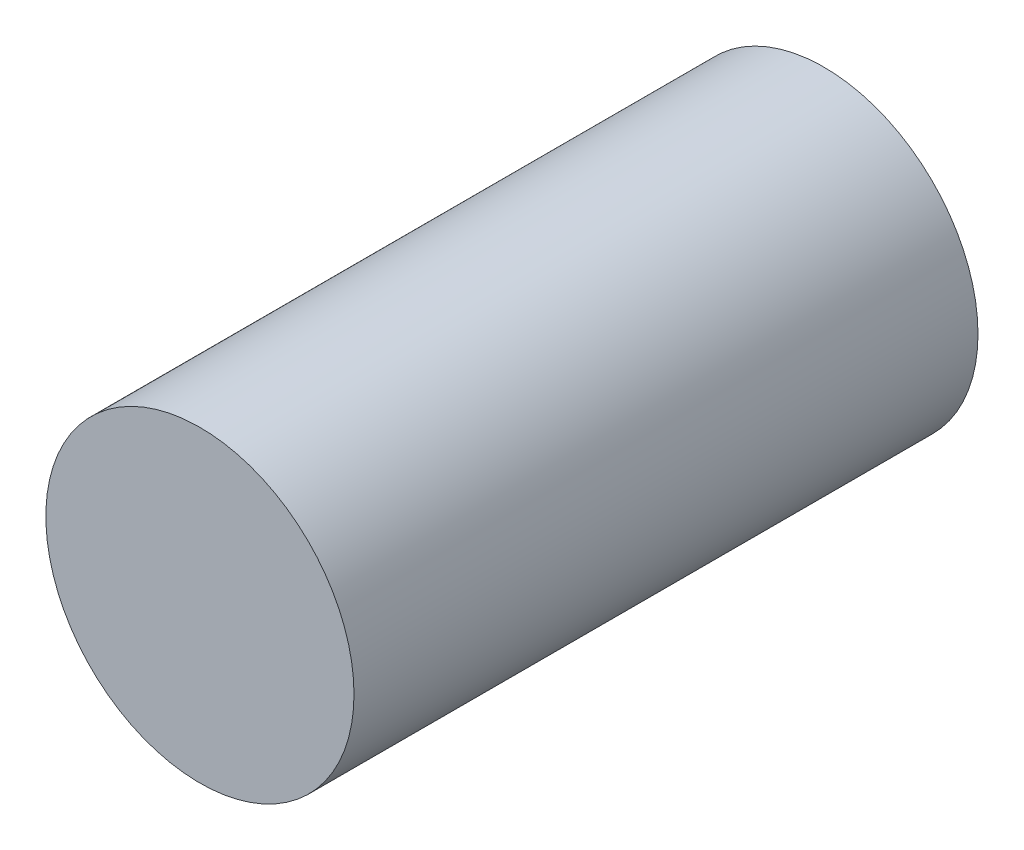
from build123d import *

# Parameters (mm, degrees)
SKETCH1_R           = 40
BOSS_EXTRUDE1_DEPTH = 162


with BuildPart() as part:
    # Sketch1 → Boss-Extrude1 (new body)
    with BuildSketch(Plane.XY):
        Circle(SKETCH1_R)
    extrude(amount=BOSS_EXTRUDE1_DEPTH)


solid = part.part
